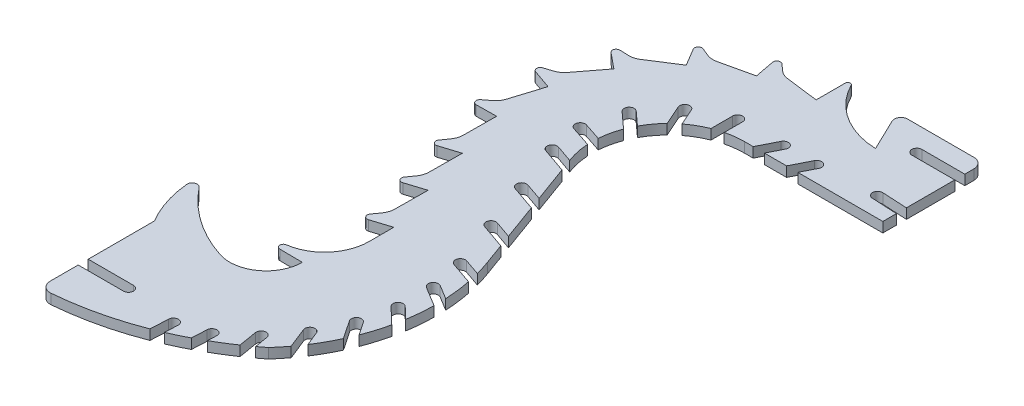
from build123d import *

# Parameters (mm, degrees)
BOSS_EXTRUDE1_DEPTH = 1.5


with BuildPart() as part:
    # Sketch2 → Boss-Extrude1 (new, symmetric)
    with BuildSketch(Plane(origin=(0, 0, 0), x_dir=(1, 0, 0), z_dir=(0, 1, 0))):
        with BuildLine():
            Line((30.591679445, -19.706623157), (10.7720134, -19.706623157))
            ThreePointArc((10.7720134, -19.706623157), (9.078054648, -20.64337166), (8.970909221, -22.576119411))
            Line((8.970909221, -22.576119411), (13.591679445, -32.147740359))
            ThreePointArc((13.591679445, -32.147740359), (1.806509532, -28.502211598), (-6.481867926, -19.365313385))
            ThreePointArc((-6.481867926, -19.365313385), (-7.32973333, -18.973264537), (-7.908320555, -19.706623157))
            Line((-7.908320555, -19.706623157), (-7.908320555, -28.432506119))
            Line((-7.908320555, -28.432506119), (-17.717270868, -27.188248579))
            ThreePointArc((-17.717270868, -27.188248579), (-19.171094461, -26.773433157), (-20.434473097, -25.943042105))
            Line((-20.434473097, -25.943042105), (-22.368798662, -24.20065732))
            ThreePointArc((-22.368798662, -24.20065732), (-23.645178784, -24.059731732), (-24.18540608, -25.224704137))
            Line((-24.18540608, -25.224704137), (-23.052018923, -31.147740359))
            Line((-23.052018923, -31.147740359), (-32.696701915, -33.325760801))
            ThreePointArc((-32.696701915, -33.325760801), (-34.204808853, -33.432007408), (-35.675731358, -33.082633883))
            Line((-35.675731358, -33.082633883), (-38.088561944, -32.104999648))
            ThreePointArc((-38.088561944, -32.104999648), (-39.336406178, -32.408134936), (-39.446620498, -33.687532857))
            Line((-39.446620498, -33.687532857), (-36.359878937, -38.868165161))
            Line((-36.359878937, -38.868165161), (-44.682209683, -44.206937867))
            ThreePointArc((-44.682209683, -44.206937867), (-46.063514085, -44.821488945), (-47.565359499, -44.99508396))
            Line((-47.565359499, -44.99508396), (-50.166974568, -44.899589667))
            ThreePointArc((-50.166974568, -44.899589667), (-51.236448069, -45.610386873), (-50.903415433, -46.850586655))
            Line((-50.903415433, -46.850586655), (-46.233959836, -50.666750824))
            Line((-46.233959836, -50.666750824), (-52.234634805, -58.525222875))
            ThreePointArc((-52.234634805, -58.525222875), (-53.323276599, -59.574286229), (-54.675710894, -60.250005368))
            Line((-54.675710894, -60.250005368), (-57.153721622, -61.048117491))
            ThreePointArc((-57.153721622, -61.048117491), (-57.916407401, -62.081227669), (-57.18011669, -63.133312373))
            Line((-57.18011669, -63.133312373), (-51.488631752, -65.126782646))
            Line((-51.488631752, -65.126782646), (-54.447120137, -74.561348325))
            ThreePointArc((-54.447120137, -74.561348325), (-55.112380704, -75.918957714), (-56.153010385, -77.01566403))
            Line((-56.153010385, -77.01566403), (-58.209869733, -78.611549287))
            ThreePointArc((-58.209869733, -78.611549287), (-58.574188326, -79.842921773), (-57.523049617, -80.58056237))
            Line((-57.523049617, -80.58056237), (-51.492940164, -80.511972885))
            Line((-51.492940164, -80.511972885), (-51.584718331, -90.399098849))
            ThreePointArc((-51.584718331, -90.399098849), (-51.827147904, -91.891379915), (-52.504528151, -93.242982992))
            Line((-52.504528151, -93.242982992), (-54.009427976, -95.367317393))
            ThreePointArc((-54.009427976, -95.367317393), (-54.000531493, -96.651422953), (-52.780504026, -97.052096404))
            Line((-52.780504026, -97.052096404), (-47.030071383, -95.235657869))
            Line((-47.030071383, -95.235657869), (-47.12184955, -105.122783833))
            ThreePointArc((-47.12184955, -105.122783833), (-47.364279123, -106.615064898), (-48.04165937, -107.966667975))
            Line((-48.04165937, -107.966667975), (-49.546559195, -110.091002377))
            ThreePointArc((-49.546559195, -110.091002377), (-49.537662712, -111.375107936), (-48.317635245, -111.775781388))
            Line((-48.317635245, -111.775781388), (-42.567202602, -109.959342852))
            Line((-42.567202602, -109.959342852), (-42.658980769, -119.846468816))
            ThreePointArc((-42.658980769, -119.846468816), (-42.901410342, -121.338749882), (-43.578790589, -122.690352959))
            Line((-43.578790589, -122.690352959), (-45.083690414, -124.81468736))
            ThreePointArc((-45.083690414, -124.81468736), (-45.074793931, -126.09879292), (-43.854766464, -126.499466371))
            Line((-43.854766464, -126.499466371), (-38.104333821, -124.683027836))
            Line((-38.104333821, -124.683027836), (-38.104333821, -132.09846141))
            ThreePointArc((-38.104333821, -132.09846141), (-41.390896914, -140.865197103), (-49.630647576, -145.310830995))
            ThreePointArc((-49.630647576, -145.310830995), (-50.538285298, -146.425626752), (-49.487786241, -147.406966419))
            Line((-49.487786241, -147.406966419), (-42.695203119, -147.470019204))
            ThreePointArc((-42.695203119, -147.470019204), (-47.251074553, -156.251479907), (-57.02749202, -157.765308857))
            ThreePointArc((-57.02749202, -157.765308857), (-68.364215606, -152.127529815), (-77.601312333, -143.468320944))
            ThreePointArc((-77.601312333, -143.468320944), (-79.308701216, -143.01747095), (-80.227840105, -144.52532579))
            ThreePointArc((-80.227840105, -144.52532579), (-78.693531531, -151.963379675), (-75.571880263, -158.886821144))
            Line((-75.571880263, -158.886821144), (-75.571880263, -178.706821144))
            Line((-75.571880263, -178.706821144), (-62.012239263, -178.706821144))
            ThreePointArc((-62.012239263, -178.706821144), (-60.512239263, -180.206821144), (-62.012239263, -181.706821144))
            Line((-62.012239263, -181.706821144), (-75.571880263, -181.706821144))
            Line((-75.571880263, -181.706821144), (-75.571880263, -190.103648045))
            ThreePointArc((-75.571880263, -190.103648045), (-74.601802954, -192.31258758), (-72.318937683, -193.092965702))
            ThreePointArc((-72.318937683, -193.092965702), (-60.088428307, -191.172622706), (-48.255167855, -187.532976584))
            Line((-48.255167855, -187.532976584), (-47.991619574, -182.190472639))
            ThreePointArc((-47.991619574, -182.190472639), (-46.419535523, -180.766200285), (-44.99526317, -182.338284336))
            Line((-44.99526317, -182.338284336), (-45.189570528, -186.277174862))
            ThreePointArc((-45.189570528, -186.277174862), (-42.426706717, -185.025671711), (-39.709222418, -183.678468808))
            Line((-39.709222418, -183.678468808), (-39.486721817, -179.168060553))
            ThreePointArc((-39.486721817, -179.168060553), (-37.914637766, -177.743788199), (-36.490365413, -179.31587225))
            Line((-36.490365413, -179.31587225), (-36.622806434, -182.00064286))
            ThreePointArc((-36.622806434, -182.00064286), (-33.568117965, -180.175222106), (-30.590762677, -178.226212601))
            Line((-30.590762677, -178.226212601), (-31.505833228, -172.73534794))
            ThreePointArc((-31.505833228, -172.73534794), (-30.272818323, -171.009174645), (-28.546645028, -172.24218955))
            Line((-28.546645028, -172.24218955), (-27.872343878, -176.288321681))
            ThreePointArc((-27.872343878, -176.288321681), (-26.787296496, -175.469683596), (-25.715192007, -174.63416693))
            ThreePointArc((-25.715192007, -174.63416693), (-24.131271892, -172.792491831), (-22.631138333, -170.881950179))
            Line((-22.631138333, -170.881950179), (-25.076513826, -164.751725562))
            ThreePointArc((-25.076513826, -164.751725562), (-24.239043456, -162.80271469), (-22.290032584, -163.640185061))
            Line((-22.290032584, -163.640185061), (-20.574340605, -167.941192099))
            ThreePointArc((-20.574340605, -167.941192099), (-18.553427823, -164.579630172), (-16.779957492, -161.081203377))
            Line((-16.779957492, -161.081203377), (-20.493243678, -155.582864729))
            ThreePointArc((-20.493243678, -155.582864729), (-20.08967623, -153.500286203), (-18.007097704, -153.903853651))
            Line((-18.007097704, -153.903853651), (-15.385652544, -157.785481008))
            ThreePointArc((-15.385652544, -157.785481008), (-14.110645837, -154.078891897), (-13.1058259, -150.290121407))
            Line((-13.1058259, -150.290121407), (-17.965948842, -145.648723848))
            ThreePointArc((-17.965948842, -145.648723848), (-18.014768788, -143.527965348), (-15.894010288, -143.479145402))
            Line((-15.894010288, -143.479145402), (-12.430549265, -146.786736534))
            ThreePointArc((-12.430549265, -146.786736534), (-11.95484064, -142.892533529), (-11.760997702, -138.974174094))
            Line((-11.760997702, -138.974174094), (-17.610386199, -135.404313204))
            ThreePointArc((-17.610386199, -135.404313204), (-18.109357454, -133.342511155), (-16.047555405, -132.8435399))
            Line((-16.047555405, -132.8435399), (-11.829755074, -135.417648366))
            ThreePointArc((-11.829755074, -135.417648366), (-12.176031219, -131.500664891), (-12.804327894, -127.618924303))
            Line((-12.804327894, -127.618924303), (-19.44284147, -125.318854269))
            ThreePointArc((-19.44284147, -125.318854269), (-20.369109813, -123.410444734), (-18.460700277, -122.484176391))
            Line((-18.460700277, -122.484176391), (-13.610256797, -124.16472725))
            ThreePointArc((-13.610256797, -124.16472725), (-14.277755396, -121.875672695), (-15.044910568, -119.618063766))
            Line((-15.044910568, -119.618063766), (-17.284941751, -113.47159106))
            Line((-17.284941751, -113.47159106), (-24.696307823, -110.903748001))
            ThreePointArc((-24.696307823, -110.903748001), (-25.622576166, -108.995338465), (-23.71416663, -108.069070122))
            Line((-23.71416663, -108.069070122), (-18.609250916, -109.837788906))
            Line((-18.609250916, -109.837788906), (-22.538408103, -99.056484792))
            Line((-22.538408103, -99.056484792), (-29.949774176, -96.488641733))
            ThreePointArc((-29.949774176, -96.488641733), (-30.876042519, -94.580232197), (-28.967632983, -93.653963854))
            Line((-28.967632983, -93.653963854), (-23.862717269, -95.422682638))
            Line((-23.862717269, -95.422682638), (-27.791874456, -84.641378524))
            Line((-27.791874456, -84.641378524), (-35.203240529, -82.073535465))
            ThreePointArc((-35.203240529, -82.073535465), (-36.129508872, -80.165125929), (-34.221099336, -79.238857586))
            Line((-34.221099336, -79.238857586), (-29.116183622, -81.00757637))
            ThreePointArc((-29.116183622, -81.00757637), (-30.1141914, -77.651243282), (-30.588013113, -74.181879608))
            Line((-30.588013113, -74.181879608), (-36.721638819, -72.148081411))
            ThreePointArc((-36.721638819, -72.148081411), (-37.673313604, -70.252213508), (-35.777445701, -69.300538724))
            Line((-35.777445701, -69.300538724), (-30.556950774, -71.031559441))
            ThreePointArc((-30.556950774, -71.031559441), (-30.085277477, -67.879812555), (-29.179973773, -64.824258704))
            Line((-29.179973773, -64.824258704), (-33.96481563, -60.481104573))
            ThreePointArc((-33.96481563, -60.481104573), (-34.067342644, -58.36226333), (-31.948501401, -58.259736316))
            Line((-31.948501401, -58.259736316), (-27.875992931, -61.956312402))
            ThreePointArc((-27.875992931, -61.956312402), (-26.168557811, -59.265466913), (-24.103577818, -56.83815528))
            Line((-24.103577818, -56.83815528), (-26.720078495, -50.929549385))
            ThreePointArc((-26.720078495, -50.929549385), (-25.955896706, -48.95065419), (-23.977001511, -49.71483598))
            Line((-23.977001511, -49.71483598), (-21.750026934, -54.743810452))
            ThreePointArc((-21.750026934, -54.743810452), (-19.099282912, -52.974759784), (-16.228320555, -51.591445186))
            Line((-16.228320555, -51.591445186), (-16.228320555, -45.129425423))
            ThreePointArc((-16.228320555, -45.129425423), (-14.728320555, -43.629425423), (-13.228320555, -45.129425423))
            Line((-13.228320555, -45.129425423), (-13.228320555, -50.629425423))
            ThreePointArc((-13.228320555, -50.629425423), (-10.515640107, -50.132928523), (-7.762916563, -49.966623157))
            Line((-7.762916563, -49.966623157), (-5.215012395, -49.966623157))
            Line((-5.215012395, -49.966623157), (-2.41689742, -44.432360118))
            ThreePointArc((-2.41689742, -44.432360118), (-0.401458618, -43.770539571), (0.260361929, -45.785978373))
            Line((0.260361929, -45.785978373), (-1.853365715, -49.966623157))
            Line((-1.853365715, -49.966623157), (4.773622534, -49.966623157))
            Line((4.773622534, -49.966623157), (7.571737509, -44.432360118))
            ThreePointArc((7.571737509, -44.432360118), (9.587176311, -43.770539571), (10.248996858, -45.785978373))
            Line((10.248996858, -45.785978373), (8.135269213, -49.966623157))
            Line((8.135269213, -49.966623157), (33.591679445, -49.966623157))
            Line((33.591679445, -49.966623157), (33.591679445, -45.906623157))
            Line((33.591679445, -45.906623157), (25.981119813, -45.507770628))
            ThreePointArc((25.981119813, -45.507770628), (24.561679445, -43.931322391), (26.138127682, -42.511882023))
            Line((26.138127682, -42.511882023), (33.591679445, -42.902506119))
            Line((33.591679445, -42.902506119), (33.591679445, -28.432506119))
            Line((33.591679445, -28.432506119), (20.741679445, -28.432506119))
            ThreePointArc((20.741679445, -28.432506119), (19.241679445, -26.932506119), (20.741679445, -25.432506119))
            Line((20.741679445, -25.432506119), (33.591679445, -25.432506119))
            Line((33.591679445, -25.432506119), (33.591679445, -22.706623157))
            ThreePointArc((33.591679445, -22.706623157), (32.712999789, -20.585302814), (30.591679445, -19.706623157))
        make_face()
    extrude(amount=BOSS_EXTRUDE1_DEPTH, both=True)


solid = part.part
